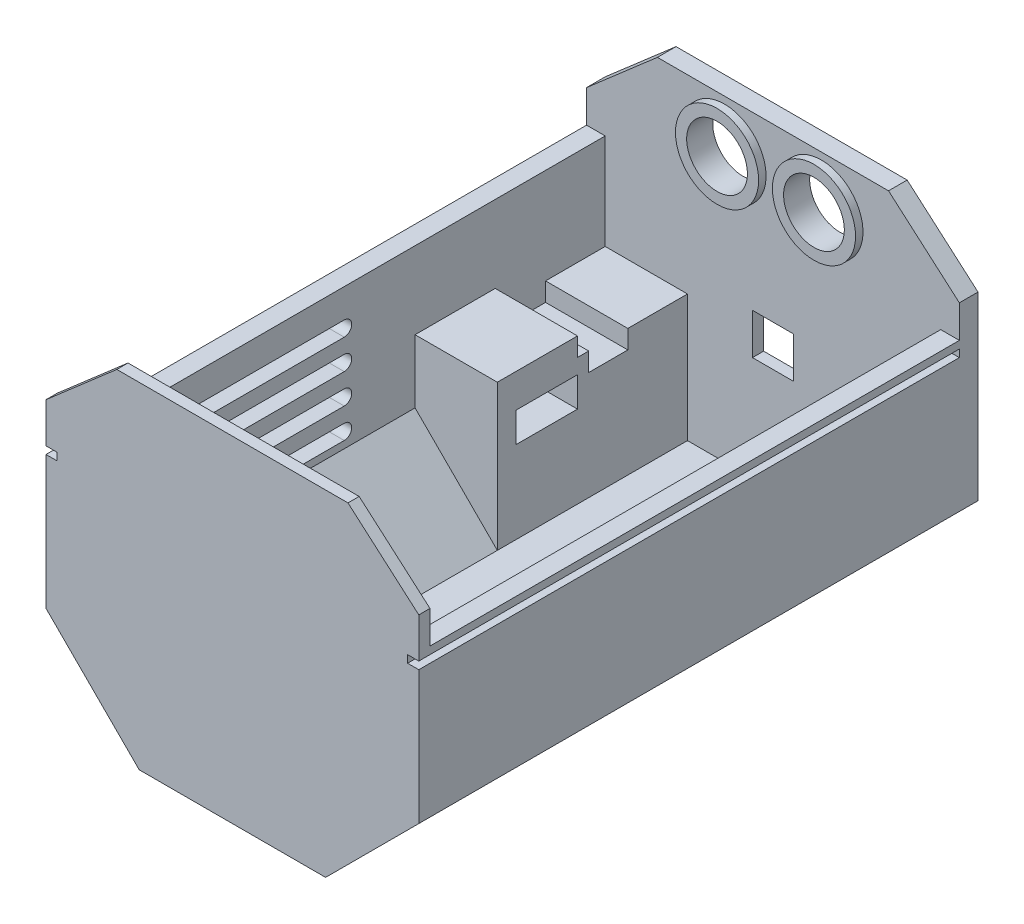
from build123d import *

# Parameters (mm, degrees)
BOSS_EXTRUDE2_DEPTH  = 150
CUT_EXTRUDE2_DEPTH   = 145
CUT_EXTRUDE4_DEPTH   = 145
BOSS_EXTRUDE3_DEPTH  = 90
SKETCH10_W           = 14
SKETCH10_H           = 8
SKETCH10_W_2         = 8.5
SKETCH10_H_2         = 3.2
CUT_EXTRUDE5_DEPTH   = 189.01595677
SKETCH11_W           = 11
SKETCH11_H           = 11
CUT_EXTRUDE6_DEPTH   = 187.413518823
SKETCH12_R           = 11.15
SKETCH12_R_2         = 8.15
BOSS_EXTRUDE4_DEPTH  = 2
SKETCH13_R           = 8.15
CUT_EXTRUDE7_DEPTH   = 187.413518823
CHAMFER1_SIZE        = 2
CUT_EXTRUDE8_REACH   = 166.515
SKETCH14_W           = 45.857864376
SKETCH14_H           = 8
BOSS_EXTRUDE5_REACH  = 179.757
SKETCH15_W           = 22.071067812
SKETCH15_H           = 16.5
BOSS_EXTRUDE6_REACH  = 179.757
SKETCH16_W           = 22.071067812
SKETCH16_H           = 16.5
BOSS_EXTRUDE7_DEPTH  = 22.071067812
BOSS_EXTRUDE9_DEPTH  = 3
SKETCH19_W           = 1
SKETCH19_H           = 2
BOSS_EXTRUDE10_DEPTH = 142
CUT_EXTRUDE9_DEPTH   = 151.203195705
SKETCH21_W           = 16.5
SKETCH21_H           = 8
CUT_EXTRUDE10_DEPTH  = 200.060292374
SKETCH22_W           = 6.5
SKETCH22_H           = 3.5
CUT_EXTRUDE11_DEPTH  = 10
CUT_EXTRUDE13_DEPTH  = 5
CUT_EXTRUDE15_DEPTH  = 2.5
SKETCH28_R           = 3.8
CUT_EXTRUDE16_DEPTH  = 190.15932438
BOSS_EXTRUDE11_DEPTH = 13


with BuildPart() as part:
    # Sketch1 → Boss-Extrude2 (new body)
    with BuildSketch(Plane.XY):
        Polygon((0, 0), (50, 0), (75, 25), (75, 73.483551981), (56, 90), (-6, 90), (-25, 73.483551981), (-25, 25), align=None)
    extrude(amount=BOSS_EXTRUDE2_DEPTH)

    # Sketch3 → Cut-Extrude2 (cut)
    with BuildSketch(Plane.XY.offset(150)):
        Polygon((-4.130576603, 85), (-20, 71.204920704), (-20, 27.071067812), (2.071067812, 5), (47.928932188, 5), (70, 27.071067812), (70, 71.204920704), (54.130576603, 85), align=None)
    extrude(amount=-CUT_EXTRUDE2_DEPTH, mode=Mode.SUBTRACT)

    # Sketch8 → Cut-Extrude4 (cut)
    with BuildSketch(Plane.XY.offset(150)):
        Polygon((-6, 90), (-25, 73.483551981), (-25, 60.75095761), (-22, 60.75095761), (-22, 62.75095761), (-24, 62.75095761), (-24, 64.75095761), (-20, 64.75095761), (-20, 71.204920704), (-4.130576603, 85), (54.130576603, 85), (70, 71.204920704), (70, 64.75095761), (74, 64.75095761), (74, 62.75095761), (72, 62.75095761), (72, 60.75095761), (75, 60.75095761), (75, 73.483551981), (56, 90), align=None)
    extrude(amount=-CUT_EXTRUDE4_DEPTH, mode=Mode.SUBTRACT)

    # Sketch9 → Boss-Extrude3 (add)
    with BuildSketch(Plane.ZY.offset(-70)):
        Polygon((21, 34.071067812), (31.5, 34.071067812), (31.5, 39.071067812), (34.5, 39.071067812), (34.5, 31.071067812), (18, 31.071067812), (18, 39.071067812), (21, 39.071067812), align=None)
    extrude(amount=BOSS_EXTRUDE3_DEPTH)

    # Sketch10 → Cut-Extrude5 (cut, through all)
    with BuildSketch(Plane(origin=(0, 5, 0), x_dir=(1, 0, 0), z_dir=(0, 1, 0))):
        with Locations((25, -12)):
            Rectangle(SKETCH10_W, SKETCH10_H)
        with Locations((25, -49.625084235)):
            Rectangle(SKETCH10_W_2, SKETCH10_H_2)
    extrude(amount=-CUT_EXTRUDE5_DEPTH, mode=Mode.SUBTRACT)

    # Sketch11 → Cut-Extrude6 (cut, through all)
    with BuildSketch(Plane.XY.offset(5)):
        with Locations((25, 38.5)):
            Rectangle(SKETCH11_W, SKETCH11_H)
    extrude(amount=-CUT_EXTRUDE6_DEPTH, mode=Mode.SUBTRACT)

    # Sketch12 → Boss-Extrude4 (add)
    # profile 1 of 2: a face of its own
    with BuildSketch(Plane.XY.offset(5)):
        with Locations(Location((12, 77, 0), (0, 0, 180))):
            Circle(SKETCH12_R)
        with Locations((12, 77)):
            Circle(SKETCH12_R_2, mode=Mode.SUBTRACT)
    # profile 2 of 2: a face of its own
    with BuildSketch(Plane.XY.offset(5)):
        with Locations(Location((38, 77, 0), (0, 0, 180))):
            Circle(SKETCH12_R)
        with Locations((38, 77)):
            Circle(SKETCH12_R_2, mode=Mode.SUBTRACT)
    extrude(amount=BOSS_EXTRUDE4_DEPTH)

    # Sketch13 → Cut-Extrude7 (cut, through all)
    with BuildSketch(Plane.XY.offset(5)):
        with Locations((12, 77)):
            Circle(SKETCH13_R)
        with Locations((38, 77)):
            Circle(SKETCH13_R)
    extrude(amount=-CUT_EXTRUDE7_DEPTH, mode=Mode.SUBTRACT)

    # Chamfer1
    chamfer1_edges = [part.edges().sort_by_distance(p)[0] for p in [
        (19.5, 38.5, 0),
        (25, 44, 0),
        (30.5, 38.5, 0),
        (25, 33, 0),
    ]]
    chamfer(chamfer1_edges, length=CHAMFER1_SIZE)

    # Cut-Extrude8: up to this face of the body (flat: up to its plane)
    cut_extrude8_end = Plane(part.part.faces().sort_by_distance((25, 35.071067812, 18))[0])
    # Sketch14 → Cut-Extrude8 (cut, up to the picked face)
    with BuildSketch(Plane.XY.offset(34.5), mode=Mode.PRIVATE) as cut_extrude8_sk1:
        with Locations((25, 35.071067812)):
            Rectangle(SKETCH14_W, SKETCH14_H)
    cut_extrude8_tool1 = split(extrude(cut_extrude8_sk1.sketch, amount=-CUT_EXTRUDE8_REACH, mode=Mode.PRIVATE), bisect_by=cut_extrude8_end, keep=Keep.BOTH, mode=Mode.PRIVATE)
    add(cut_extrude8_tool1.solids().sort_by(Axis((25, 35.071068, 34.5), (0, 0, -1)))[0], mode=Mode.SUBTRACT)

    # Boss-Extrude5: up to this plane
    boss_extrude5_end = Plane(origin=(47.928932188, 5, -120.415945788), z_dir=(0.7071067811865476, -0.7071067811865475, 0))
    # Sketch15 → Boss-Extrude5 (add, up to the surface)
    with BuildSketch(Plane.XZ.offset(-31.071067812), mode=Mode.PRIVATE) as boss_extrude5_sk1:
        with Locations((58.964466094, 26.25)):
            Rectangle(SKETCH15_W, SKETCH15_H)
    boss_extrude5_tool1 = split(extrude(boss_extrude5_sk1.sketch, amount=BOSS_EXTRUDE5_REACH, mode=Mode.PRIVATE), bisect_by=boss_extrude5_end, keep=Keep.BOTH, mode=Mode.PRIVATE)
    add(boss_extrude5_tool1.solids().sort_by_distance((58.964466, 31.071068, 26.25))[0])

    # Boss-Extrude6: up to this plane
    boss_extrude6_end = Plane(origin=(-20, 27.071067812, -120.415945788), z_dir=(-0.7071067811865475, -0.7071067811865476, 0))
    # Sketch16 → Boss-Extrude6 (add, up to the surface)
    with BuildSketch(Plane.XZ.offset(-31.071067812), mode=Mode.PRIVATE) as boss_extrude6_sk1:
        with Locations((-8.964466094, 26.25)):
            Rectangle(SKETCH16_W, SKETCH16_H)
    boss_extrude6_tool1 = split(extrude(boss_extrude6_sk1.sketch, amount=BOSS_EXTRUDE6_REACH, mode=Mode.PRIVATE), bisect_by=boss_extrude6_end, keep=Keep.BOTH, mode=Mode.PRIVATE)
    add(boss_extrude6_tool1.solids().sort_by_distance((-8.964466, 31.071068, 26.25))[0])

    # Sketch17 → Boss-Extrude7 (add)
    with BuildSketch(Plane(origin=(-20, 0, 0), x_dir=(0, 0, -1), z_dir=(1, 0, 0))):
        Polygon((-56, 27.071067812), (-51, 27.071067812), (-51, 35.071067812), (-34.5, 35.071067812), (-34.5, 39.071067812), (-34.5, 44.071067812), (-56, 44.071067812), align=None)
        Polygon((-34.5, 5), (-34.5, 27.071067812), (-51, 27.071067812), (-56, 27.071067812), (-56, 5), align=None)
    extrude(amount=BOSS_EXTRUDE7_DEPTH)

    # Sketch18 → Boss-Extrude9 (add)
    with BuildSketch(Plane.XY.offset(150)):
        Polygon((75, 62.75095761), (75, 73.483551981), (56, 90), (-6, 90), (-25, 73.483551981), (-25, 62.75095761), (-24, 62.75095761), (-24, 64.75095761), (-20, 64.75095761), (-20, 27.071067812), (2.071067812, 5), (47.928932188, 5), (70, 27.071067812), (70, 64.75095761), (74, 64.75095761), (74, 62.75095761), align=None)
    extrude(amount=-BOSS_EXTRUDE9_DEPTH)

    # Sketch19 → Boss-Extrude10 (add)
    with BuildSketch(Plane(origin=(0, 0, 147), x_dir=(-1, 0, 0), z_dir=(0, 0, -1))):
        with Locations((-74.5, 63.75095761)):
            Rectangle(SKETCH19_W, SKETCH19_H)
        with Locations((24.5, 63.75095761)):
            Rectangle(SKETCH19_W, SKETCH19_H)
    extrude(amount=BOSS_EXTRUDE10_DEPTH)

    # Sketch20 → Cut-Extrude9 (cut, through all)
    with BuildSketch(Plane.XY.offset(56)):
        Polygon((-5, 5), (-20, 20), (-20, 5), align=None)
    extrude(amount=-CUT_EXTRUDE9_DEPTH, mode=Mode.SUBTRACT)

    # Sketch21 → Cut-Extrude10 (cut, through all)
    with BuildSketch(Plane(origin=(-20, 0, 0), x_dir=(0, 0, -1), z_dir=(1, 0, 0))):
        with Locations((-42.75, 31.071067812)):
            Rectangle(SKETCH21_W, SKETCH21_H)
    extrude(amount=-CUT_EXTRUDE10_DEPTH, mode=Mode.SUBTRACT)

    # Sketch22 → Cut-Extrude11 (cut)
    with BuildSketch(Plane.ZY.offset(25)):
        with Locations((42.75, 36.821067812)):
            Rectangle(SKETCH22_W, SKETCH22_H)
    extrude(amount=-CUT_EXTRUDE11_DEPTH, mode=Mode.SUBTRACT)

    # Sketch23 → Cut-Extrude13 (cut)
    with BuildSketch(Plane.ZY.offset(25)):
        with BuildLine():
            Line((75, 29), (135, 29))
            ThreePointArc((135, 29), (137, 31), (135, 33))
            Line((135, 33), (75, 33))
            ThreePointArc((75, 33), (73, 31), (75, 29))
        make_face()
        with BuildLine():
            Line((135, 41), (75, 41))
            ThreePointArc((75, 41), (73, 39), (75, 37))
            Line((75, 37), (135, 37))
            ThreePointArc((135, 37), (137, 39), (135, 41))
        make_face()
        with BuildLine():
            Line((135, 49), (75, 49))
            ThreePointArc((75, 49), (73, 47), (75, 45))
            Line((75, 45), (135, 45))
            ThreePointArc((135, 45), (137, 47), (135, 49))
        make_face()
        with BuildLine():
            Line((135, 57), (75, 57))
            ThreePointArc((75, 57), (73, 55), (75, 53))
            Line((75, 53), (135, 53))
            ThreePointArc((135, 53), (137, 55), (135, 57))
        make_face()
    extrude(amount=-CUT_EXTRUDE13_DEPTH, mode=Mode.SUBTRACT)

    # Sketch27 → Cut-Extrude15 (cut)
    with BuildSketch(Plane.XZ):
        with BuildLine():
            Line((39.404762454, 81.167250077), (39.404762454, 81.166207685))
            ThreePointArc((39.404762454, 81.166207685), (41.672056129, 78.884218387), (39.404762454, 76.60222909))
            Line((39.404762454, 76.60222909), (39.404762454, 76.601183426))
            Line((39.404762454, 76.601183426), (27.659446006, 76.169652537))
            ThreePointArc((27.659446006, 76.169652537), (25.117179913, 75.085745409), (22.512932044, 76.010874907))
            Line((22.512932044, 76.010874907), (10.566254086, 76.601183426))
            ThreePointArc((10.566254086, 76.601183426), (8.393884355, 78.898098023), (10.595237546, 81.167250077))
            Line((10.595237546, 81.167250077), (22.340553994, 81.598223966))
            ThreePointArc((22.340553994, 81.598223966), (25, 82.683938251), (27.659446006, 81.598223966))
            Line((27.659446006, 81.598223966), (39.404762454, 81.167250077))
        make_face()
    extrude(amount=-CUT_EXTRUDE15_DEPTH, mode=Mode.SUBTRACT)

    # Sketch28 → Cut-Extrude16 (cut, through all)
    with BuildSketch(Plane.XZ.offset(-2.5)):
        with Locations(Location((25, 78.883938251, 0), (0, 0, 45.584691403))):
            Circle(SKETCH28_R)
    extrude(amount=-CUT_EXTRUDE16_DEPTH, mode=Mode.SUBTRACT)

    # Sketch29 → Boss-Extrude11 (add)
    with BuildSketch(Plane(origin=(0, 0, 18), x_dir=(-1, 0, 0), z_dir=(0, 0, -1))):
        Polygon((-70, 39.071067812), (-70, 27.071067812), (-47.928932188, 5), (-47.928932188, 39.071067812), align=None)
        Polygon((20, 39.071067812), (-2.071067812, 39.071067812), (-2.071067812, 5), (20, 27.071067812), align=None)
    extrude(amount=BOSS_EXTRUDE11_DEPTH)


solid = part.part
